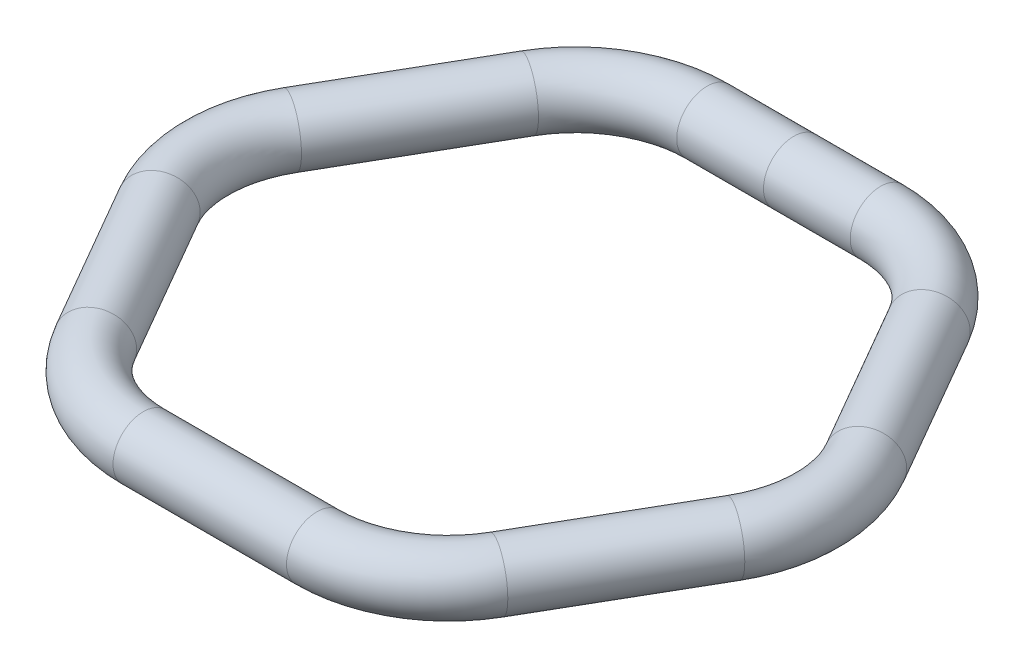
from build123d import *

# Parameters (mm, degrees)
SKETCH2_R = 7.5


with BuildPart() as part:
    # Sweep1: sweep along a path in Sketch1
    with BuildLine(Plane(origin=(0, 0, 0), x_dir=(1, 0, 0), z_dir=(0, 1, 0))) as sweep1_path:
        Line((64.490025068, 12.5), (43.070330082, 49.6))
        ThreePointArc((43.070330082, 49.6), (33.919694987, 58.750635095), (21.419694987, 62.1))
        Line((21.419694987, 62.1), (-21.419694987, 62.1))
        ThreePointArc((-21.419694987, 62.1), (-33.919694987, 58.750635095), (-43.070330082, 49.6))
        Line((-43.070330082, 49.6), (-64.490025068, 12.5))
        ThreePointArc((-64.490025068, 12.5), (-67.839389974, 0), (-64.490025068, -12.5))
        Line((-64.490025068, -12.5), (-43.070330082, -49.6))
        ThreePointArc((-43.070330082, -49.6), (-33.919694987, -58.750635095), (-21.419694987, -62.1))
        Line((-21.419694987, -62.1), (21.419694987, -62.1))
        ThreePointArc((21.419694987, -62.1), (33.919694987, -58.750635095), (43.070330082, -49.6))
        Line((43.070330082, -49.6), (64.490025068, -12.5))
        ThreePointArc((64.490025068, -12.5), (67.839389974, 0), (64.490025068, 12.5))
    # Sketch2 → Sweep1 (sweep)
    with BuildSketch(Plane(origin=(0, 0, 0), x_dir=(0, 0, -1), z_dir=(1, 0, 0))):
        with Locations((69.6, 0)):
            Circle(SKETCH2_R)
    sweep(path=sweep1_path.line)


solid = part.part
